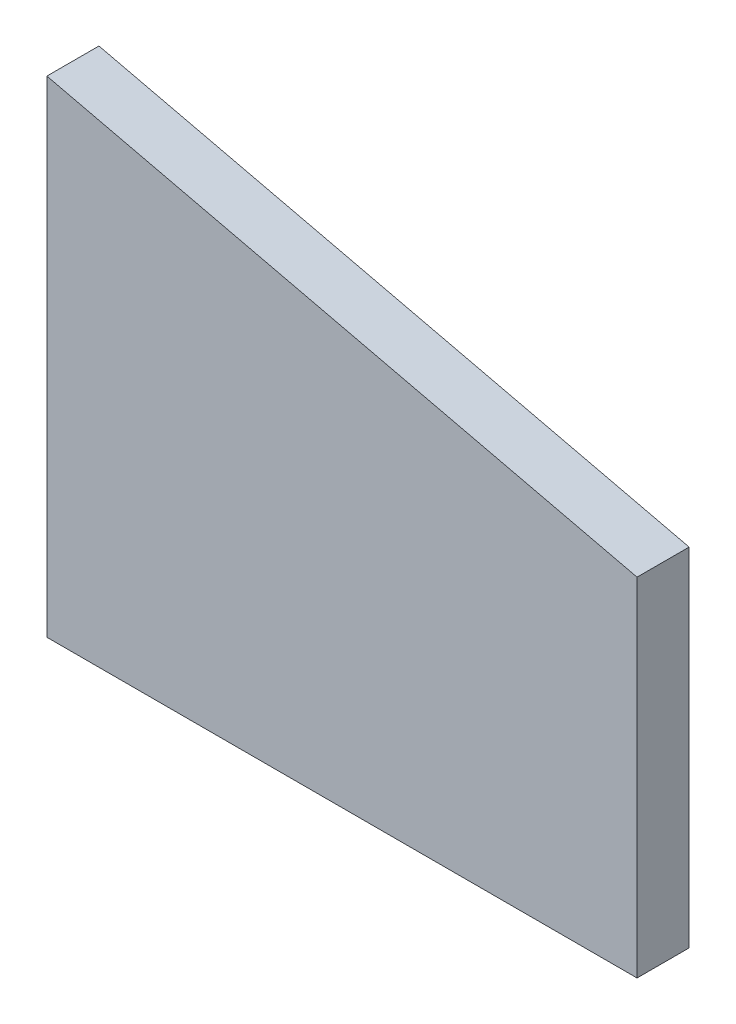
from build123d import *

# Parameters (mm, degrees)
BOSS_EXTRUDE1_DEPTH = 19.05


with BuildPart() as part:
    # Sketch1 → Boss-Extrude1 (new body)
    with BuildSketch(Plane.XY):
        Polygon((0, 0), (215.9, 0), (215.9, 127), (0, 177.8), align=None)
    extrude(amount=BOSS_EXTRUDE1_DEPTH)


solid = part.part
